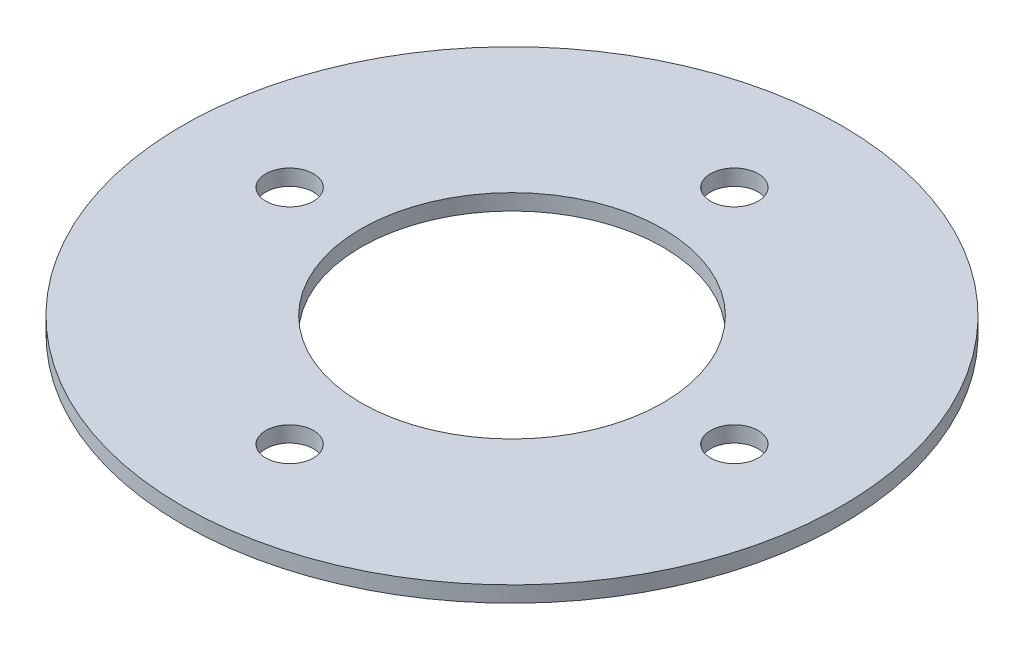
from build123d import *

# Parameters (mm, degrees)
SKETCH_1_R      = 20.75
SKETCH_1_R_2    = 1.5
SKETCH_1_R_3    = 9.5
EXTRUDE_2_DEPTH = 1


with BuildPart() as part:
    # 草图1 → 凸台-拉伸2 (new body)
    with BuildSketch(Plane(origin=(0, 0, 0), x_dir=(1, 0, 0), z_dir=(0, 1, 0))):
        with Locations(Location((0, 0, 0), (0, 0, 270))):
            Circle(SKETCH_1_R)
        with Locations(Location((0, 14, 0), (0, 0, 270))):
            Circle(SKETCH_1_R_2, mode=Mode.SUBTRACT)
        with Locations(Location((-14, 0, 0), (0, 0, 270))):
            Circle(SKETCH_1_R_2, mode=Mode.SUBTRACT)
        with Locations(Location((0, -14, 0), (0, 0, 270))):
            Circle(SKETCH_1_R_2, mode=Mode.SUBTRACT)
        with Locations(Location((14, 0, 0), (0, 0, 270))):
            Circle(SKETCH_1_R_2, mode=Mode.SUBTRACT)
        with Locations(Location((0, 0, 0), (0, 0, 270))):
            Circle(SKETCH_1_R_3, mode=Mode.SUBTRACT)
    extrude(amount=EXTRUDE_2_DEPTH)


solid = part.part
